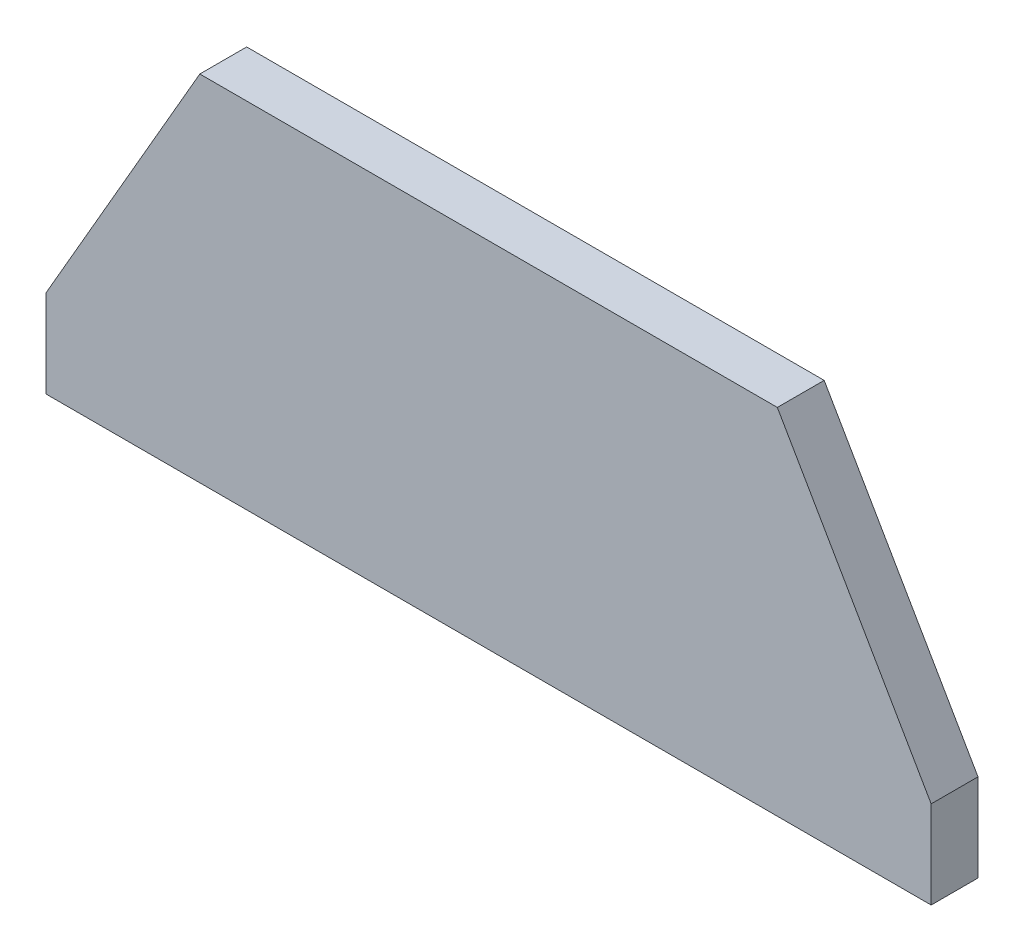
from build123d import *

# Parameters (mm, degrees)
BOSS_EXTRUDE1_DEPTH = 0.79375


with BuildPart() as part:
    # Sketch1 → Boss-Extrude1 (new, symmetric)
    with BuildSketch(Plane.XY):
        Polygon((-9.786527069, 6), (-15, -3.03), (-15, -6), (15, -6), (15, -3.03), (9.786527069, 6), align=None)
    extrude(amount=BOSS_EXTRUDE1_DEPTH, both=True)


solid = part.part
